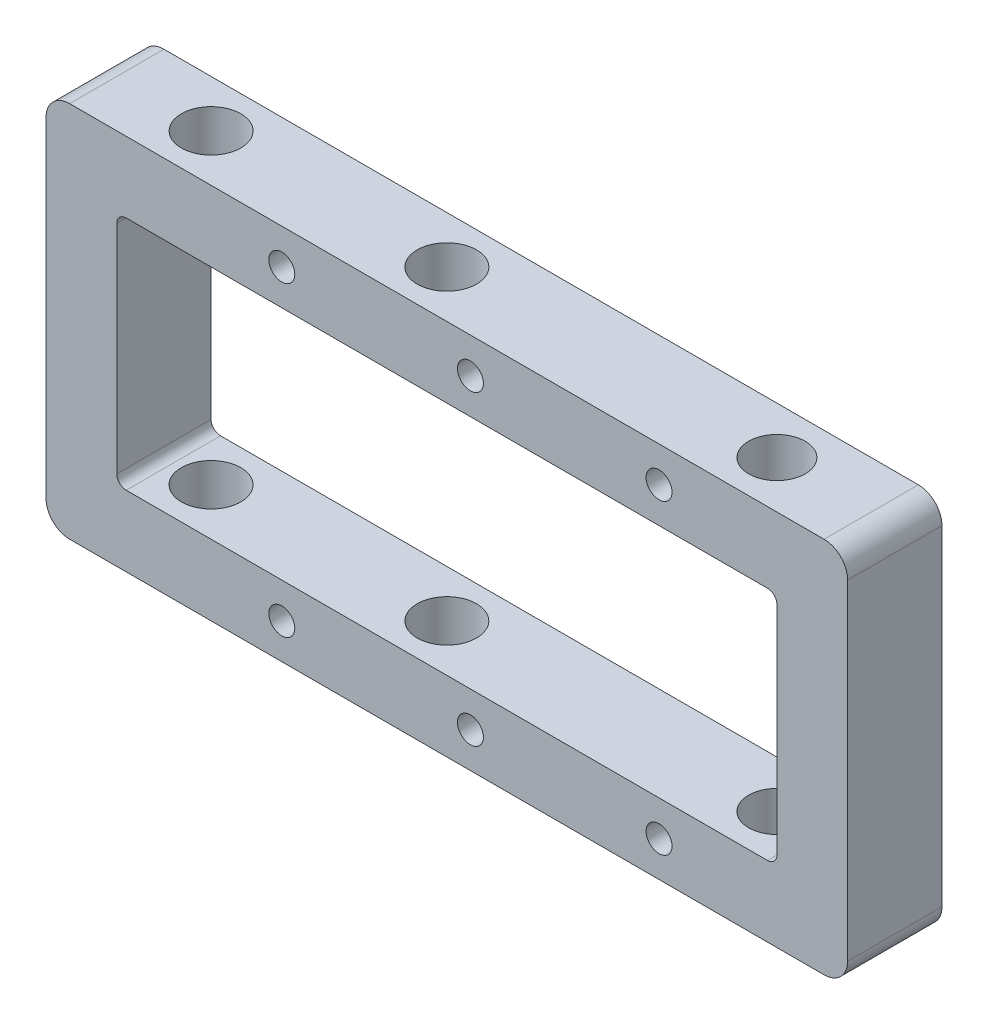
from build123d import *

# Parameters (mm, degrees)
SKETCH1_W               = 170
SKETCH1_H               = 80
SKETCH1_W_2             = 140
SKETCH1_H_2             = 50
BOSS_EXTRUDE1_DEPTH     = 20
CUT_EXTRUDE1_DEPTH      = 119.427192823
CUT_EXTRUDE1_DEPTH_BACK = 119.427192823
SKETCH2_R               = 6.3
CUT_EXTRUDE3_REACH      = 98.047
SKETCH5_R               = 2.75
FILLET1_R               = 2
FILLET2_R               = 5
SKETCH6_R               = 6
CUT_EXTRUDE4_DEPTH      = 119.427192823
SKETCH7_R               = 2.75
CUT_EXTRUDE5_DEPTH      = 97.046863561


with BuildPart() as part:
    # Sketch1 → Boss-Extrude1 (new body)
    with BuildSketch(Plane.XY):
        Rectangle(SKETCH1_W, SKETCH1_H)
        Rectangle(SKETCH1_W_2, SKETCH1_H_2, mode=Mode.SUBTRACT)
    extrude(amount=BOSS_EXTRUDE1_DEPTH)

    # Sketch2 → Cut-Extrude1 (cut, two sides: drawn at the far end of the back side and taken through both)
    with BuildSketch(Plane(origin=(0, 40, 0), x_dir=(1, 0, 0), z_dir=(0, 1, 0)).offset(-CUT_EXTRUDE1_DEPTH_BACK)):
        with Locations(Location((-60, -10, 0), (0, 0, 270))):
            Circle(SKETCH2_R)
        with Locations(Location((-10, -10, 0), (0, 0, 270))):
            Circle(SKETCH2_R)
    extrude(amount=CUT_EXTRUDE1_DEPTH + CUT_EXTRUDE1_DEPTH_BACK, mode=Mode.SUBTRACT)

    # Sketch5 → Cut-Extrude3 (cut, up to next)
    with BuildSketch(Plane(origin=(0, 0, 0), x_dir=(-1, 0, 0), z_dir=(0, 0, -1)), mode=Mode.PRIVATE) as cut_extrude3_sk1:
        with Locations((35, 32.5)):
            Circle(SKETCH5_R)
    cut_extrude3_tool1 = extrude(cut_extrude3_sk1.sketch, amount=-CUT_EXTRUDE3_REACH, mode=Mode.PRIVATE) & part.part
    # Sketch5 → Cut-Extrude3 (cut, up to next)
    with BuildSketch(Plane(origin=(0, 0, 0), x_dir=(-1, 0, 0), z_dir=(0, 0, -1)), mode=Mode.PRIVATE) as cut_extrude3_sk2:
        with Locations((35, -32.5)):
            Circle(SKETCH5_R)
    cut_extrude3_tool2 = extrude(cut_extrude3_sk2.sketch, amount=-CUT_EXTRUDE3_REACH, mode=Mode.PRIVATE) & part.part
    # Sketch5 → Cut-Extrude3 (cut, up to next)
    with BuildSketch(Plane(origin=(0, 0, 0), x_dir=(-1, 0, 0), z_dir=(0, 0, -1)), mode=Mode.PRIVATE) as cut_extrude3_sk3:
        with Locations((-5, 32.5)):
            Circle(SKETCH5_R)
    cut_extrude3_tool3 = extrude(cut_extrude3_sk3.sketch, amount=-CUT_EXTRUDE3_REACH, mode=Mode.PRIVATE) & part.part
    # Sketch5 → Cut-Extrude3 (cut, up to next)
    with BuildSketch(Plane(origin=(0, 0, 0), x_dir=(-1, 0, 0), z_dir=(0, 0, -1)), mode=Mode.PRIVATE) as cut_extrude3_sk4:
        with Locations((-5, -32.5)):
            Circle(SKETCH5_R)
    cut_extrude3_tool4 = extrude(cut_extrude3_sk4.sketch, amount=-CUT_EXTRUDE3_REACH, mode=Mode.PRIVATE) & part.part
    add(cut_extrude3_tool1.solids().sort_by_distance((-35, 32.5, 0))[0], mode=Mode.SUBTRACT)
    add(cut_extrude3_tool2.solids().sort_by_distance((-35, -32.5, 0))[0], mode=Mode.SUBTRACT)
    add(cut_extrude3_tool3.solids().sort_by_distance((5, 32.5, 0))[0], mode=Mode.SUBTRACT)
    add(cut_extrude3_tool4.solids().sort_by_distance((5, -32.5, 0))[0], mode=Mode.SUBTRACT)

    # Fillet1
    fillet1_edges = [part.edges().sort_by_distance(p)[0] for p in [
        (70, -25, 10),
        (70, 25, 10),
        (-70, 25, 10),
        (-70, -25, 10),
    ]]
    fillet(fillet1_edges, radius=FILLET1_R)

    # Fillet2
    fillet2_edges = [part.edges().sort_by_distance(p)[0] for p in [
        (85, -40, 10),
        (-85, -40, 10),
        (-85, 40, 10),
        (85, 40, 10),
    ]]
    fillet(fillet2_edges, radius=FILLET2_R)

    # Sketch6 → Cut-Extrude4 (cut, through all)
    with BuildSketch(Plane(origin=(0, 40, 0), x_dir=(1, 0, 0), z_dir=(0, 1, 0))):
        with Locations(Location((60, -10, 0), (0, 0, 270))):
            Circle(SKETCH6_R)
    extrude(amount=-CUT_EXTRUDE4_DEPTH, mode=Mode.SUBTRACT)

    # Sketch7 → Cut-Extrude5 (cut, through all)
    with BuildSketch(Plane(origin=(0, 0, 0), x_dir=(-1, 0, 0), z_dir=(0, 0, -1))):
        with Locations((-45, 32.5)):
            Circle(SKETCH7_R)
        with Locations((-45, -32.5)):
            Circle(SKETCH7_R)
    extrude(amount=-CUT_EXTRUDE5_DEPTH, mode=Mode.SUBTRACT)


solid = part.part
